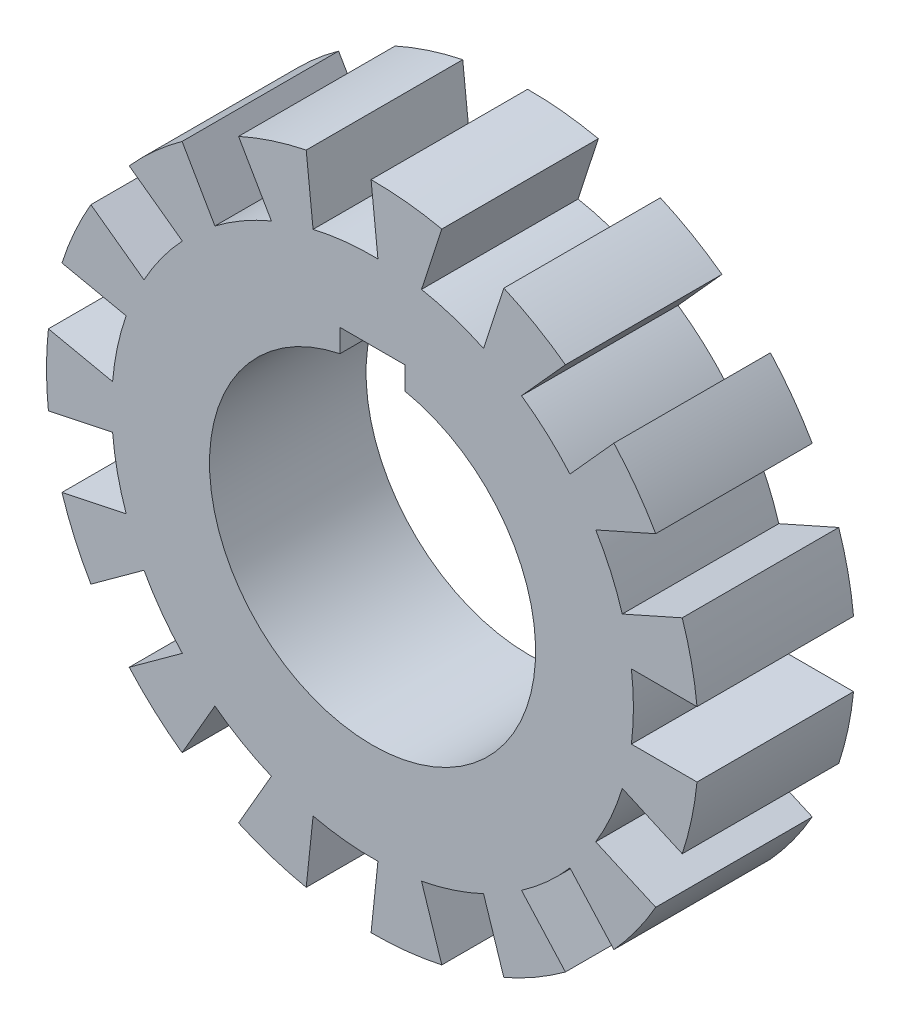
from build123d import *

# Parameters (mm, degrees)
BOSS_EXTRUDE2_DEPTH = 24


with BuildPart() as part:
    # Sketch1 → Boss-Extrude2 (new body)
    with BuildSketch(Plane.XY):
        with BuildLine():
            Line((39.686269666, 5), (49.749371855, 5))
            ThreePointArc((49.749371855, 5), (48.907380037, 10.395584541), (47.481995894, 15.667165215))
            Line((47.481995894, 15.667165215), (38.2888946, 11.574132812))
            ThreePointArc((38.2888946, 11.574132812), (36.541818306, 16.269465723), (34.221528169, 20.709587388))
            Line((34.221528169, 20.709587388), (43.414629464, 24.802619792))
            ThreePointArc((43.414629464, 24.802619792), (40.450849719, 29.389262615), (37.004551483, 33.625335233))
            Line((37.004551483, 33.625335233), (30.271021813, 26.146992913))
            ThreePointArc((30.271021813, 26.146992913), (26.765224254, 29.725793019), (22.839573558, 32.838298977))
            Line((22.839573558, 32.838298977), (29.573103228, 40.316641297))
            ThreePointArc((29.573103228, 40.316641297), (25, 43.301270189), (20.128683944, 45.769379313))
            Line((20.128683944, 45.769379313), (17.019014352, 36.198800401))
            ThreePointArc((17.019014352, 36.198800401), (12.360679775, 38.042260652), (7.508449189, 39.288970345))
            Line((7.508449189, 39.288970345), (10.618118781, 48.859549256))
            ThreePointArc((10.618118781, 48.859549256), (5.226423163, 49.726094768), (-0.227615912, 49.999481907))
            Line((-0.227615912, 49.999481907), (0.824264696, 39.991506445))
            ThreePointArc((0.824264696, 39.991506445), (-4.181138531, 39.780875815), (-9.120954258, 38.946221812))
            Line((-9.120954258, 38.946221812), (-10.172834865, 48.954197275))
            ThreePointArc((-10.172834865, 48.954197275), (-15.450849719, 47.552825815), (-20.544558909, 45.584219849))
            Line((-20.544558909, 45.584219849), (-15.513007814, 36.869317712))
            ThreePointArc((-15.513007814, 36.869317712), (-20, 34.641016151), (-24.173261852, 31.869317712))
            Line((-24.173261852, 31.869317712), (-29.204812947, 40.584219849))
            ThreePointArc((-29.204812947, 40.584219849), (-33.456530318, 37.157241274), (-37.309161029, 33.287032059))
            Line((-37.309161029, 33.287032059), (-29.167940342, 27.372089))
            ThreePointArc((-29.167940342, 27.372089), (-32.360679775, 23.511410092), (-35.045792865, 19.281919056))
            Line((-35.045792865, 19.281919056), (-43.187013552, 25.196862116))
            ThreePointArc((-43.187013552, 25.196862116), (-45.677272882, 20.336832154), (-47.622670264, 15.234214023))
            Line((-47.622670264, 15.234214023), (-37.779471002, 13.141977432))
            ThreePointArc((-37.779471002, 13.141977432), (-39.125904029, 8.316467633), (-39.85858791, 3.360501425))
            Line((-39.85858791, 3.360501425), (-49.701787172, 5.452738016))
            ThreePointArc((-49.701787172, 5.452738016), (-50, 0), (-49.701787172, -5.452738016))
            Line((-49.701787172, -5.452738016), (-39.85858791, -3.360501425))
            ThreePointArc((-39.85858791, -3.360501425), (-39.125904029, -8.316467633), (-37.779471002, -13.141977432))
            Line((-37.779471002, -13.141977432), (-47.622670264, -15.234214023))
            ThreePointArc((-47.622670264, -15.234214023), (-45.677272882, -20.336832154), (-43.187013552, -25.196862116))
            Line((-43.187013552, -25.196862116), (-35.045792865, -19.281919056))
            ThreePointArc((-35.045792865, -19.281919056), (-32.360679775, -23.511410092), (-29.167940342, -27.372089))
            Line((-29.167940342, -27.372089), (-37.309161029, -33.287032059))
            ThreePointArc((-37.309161029, -33.287032059), (-33.456530318, -37.157241274), (-29.204812947, -40.584219849))
            Line((-29.204812947, -40.584219849), (-24.173261852, -31.869317712))
            ThreePointArc((-24.173261852, -31.869317712), (-20, -34.641016151), (-15.513007814, -36.869317712))
            Line((-15.513007814, -36.869317712), (-20.544558909, -45.584219849))
            ThreePointArc((-20.544558909, -45.584219849), (-15.450849719, -47.552825815), (-10.172834865, -48.954197275))
            Line((-10.172834865, -48.954197275), (-9.120954258, -38.946221812))
            ThreePointArc((-9.120954258, -38.946221812), (-4.181138531, -39.780875815), (0.824264696, -39.991506445))
            Line((0.824264696, -39.991506445), (-0.227615912, -49.999481907))
            ThreePointArc((-0.227615912, -49.999481907), (5.226423163, -49.726094768), (10.618118781, -48.859549256))
            Line((10.618118781, -48.859549256), (7.508449189, -39.288970345))
            ThreePointArc((7.508449189, -39.288970345), (12.360679775, -38.042260652), (17.019014352, -36.198800401))
            Line((17.019014352, -36.198800401), (20.128683944, -45.769379313))
            ThreePointArc((20.128683944, -45.769379313), (25, -43.301270189), (29.573103228, -40.316641297))
            Line((29.573103228, -40.316641297), (22.839573558, -32.838298977))
            ThreePointArc((22.839573558, -32.838298977), (26.765224254, -29.725793019), (30.271021813, -26.146992913))
            Line((30.271021813, -26.146992913), (37.004551483, -33.625335233))
            ThreePointArc((37.004551483, -33.625335233), (40.450849719, -29.389262615), (43.414629464, -24.802619792))
            Line((43.414629464, -24.802619792), (34.221528169, -20.709587388))
            ThreePointArc((34.221528169, -20.709587388), (36.541818306, -16.269465723), (38.2888946, -11.574132812))
            Line((38.2888946, -11.574132812), (47.481995894, -15.667165215))
            ThreePointArc((47.481995894, -15.667165215), (48.907380037, -10.395584541), (49.749371855, -5))
            Line((49.749371855, -5), (39.686269666, -5))
            ThreePointArc((39.686269666, -5), (40, 0), (39.686269666, 5))
        make_face()
        with BuildLine():
            Line((-5, 28), (5, 28))
            Line((5, 28), (5, 24.494897428))
            ThreePointArc((5, 24.494897428), (0, -25), (-5, 24.494897428))
            Line((-5, 24.494897428), (-5, 28))
        make_face(mode=Mode.SUBTRACT)
    extrude(amount=BOSS_EXTRUDE2_DEPTH)


solid = part.part
